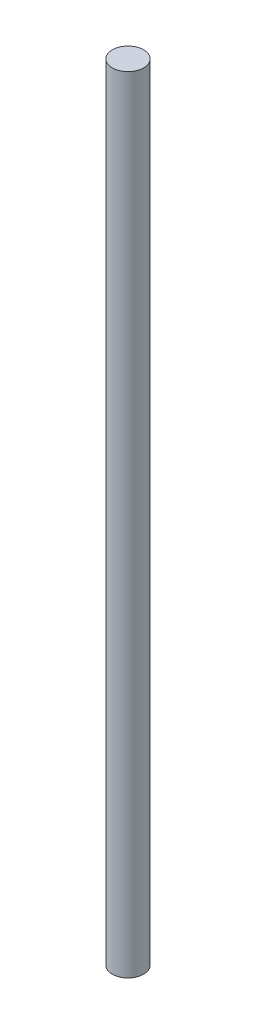
from build123d import *

# Parameters (mm, degrees)
ESQUISSE1_R        = 3
BOSS_EXTRU_1_DEPTH = 150


with BuildPart() as part:
    # Esquisse1 → Boss.-Extru.1 (new body)
    with BuildSketch(Plane(origin=(0, 0, 0), x_dir=(1, 0, 0), z_dir=(0, 1, 0))):
        with Locations(Location((0, 0, 0), (0, 0, 270))):
            Circle(ESQUISSE1_R)
    extrude(amount=BOSS_EXTRU_1_DEPTH)


solid = part.part
